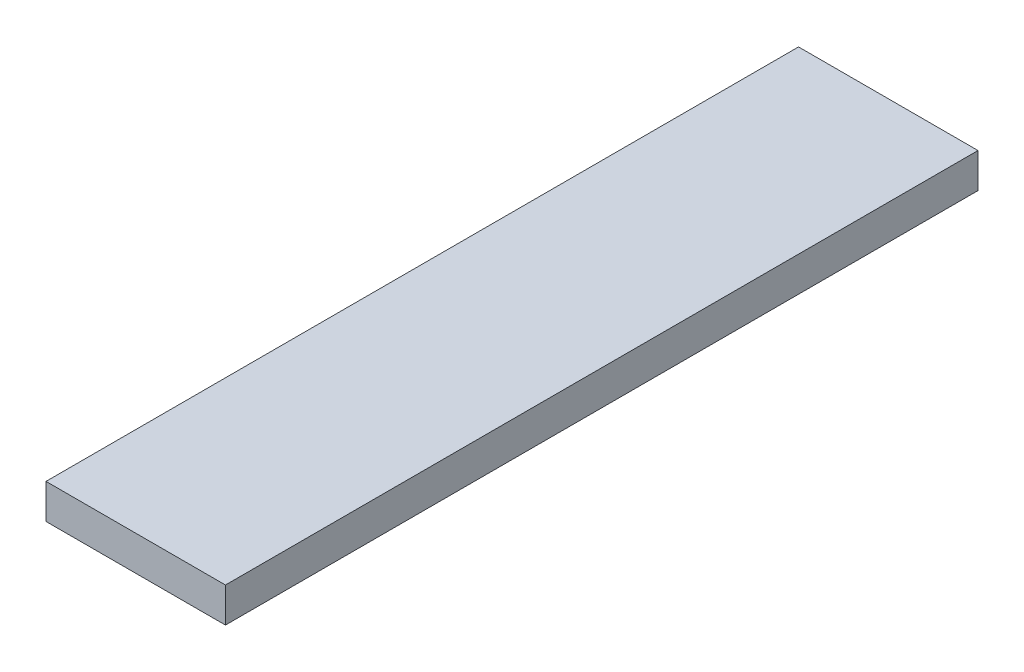
from build123d import *

# Parameters (mm, degrees)
SKETCH1_W           = 31
SKETCH1_H           = 130
BOSS_EXTRUDE1_DEPTH = 6


with BuildPart() as part:
    # Sketch1 → Boss-Extrude1 (new body)
    with BuildSketch(Plane(origin=(0, 0, 0), x_dir=(1, 0, 0), z_dir=(0, 1, 0))):
        with Locations((15.5, -65)):
            Rectangle(SKETCH1_W, SKETCH1_H)
    extrude(amount=BOSS_EXTRUDE1_DEPTH)


solid = part.part
